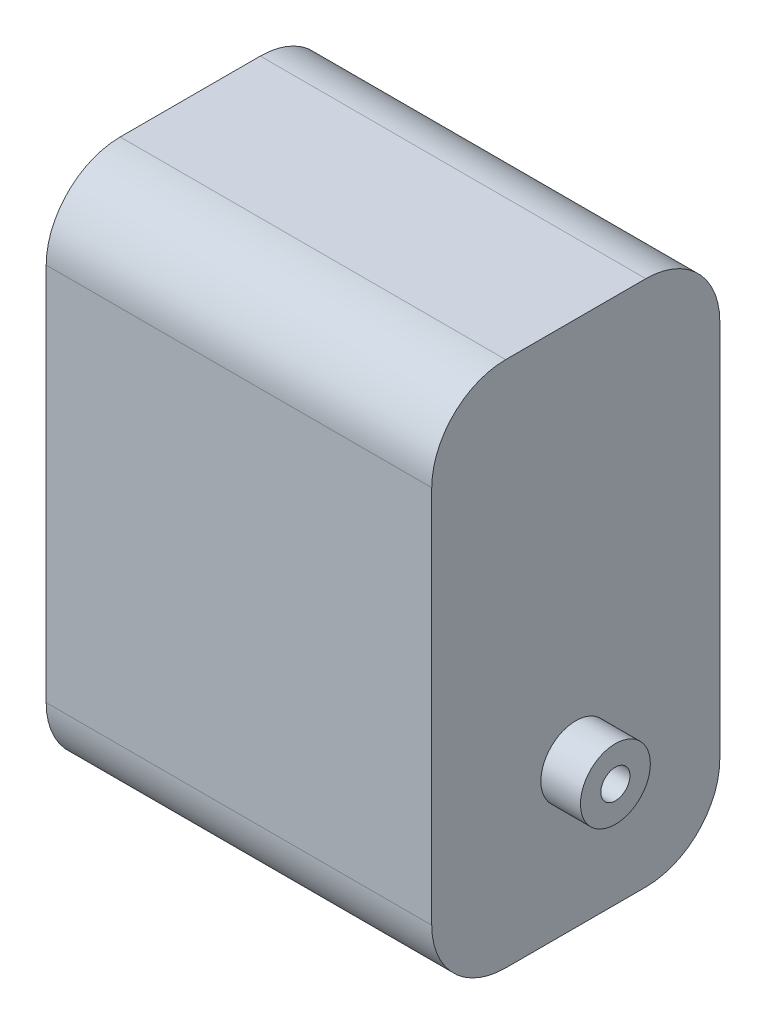
from build123d import *

# Parameters (mm, degrees)
SKETCH1_W           = 24.73
SKETCH1_H           = 45.23
BOSS_EXTRUDE1_DEPTH = 33.1
SKETCH2_R           = 3
SKETCH2_R_2         = 1.25
BOSS_EXTRUDE2_DEPTH = 3.4
FILLET1_R           = 6.35


with BuildPart() as part:
    # Sketch1 → Boss-Extrude1 (new body)
    with BuildSketch(Plane(origin=(0, 0, 0), x_dir=(0, 0, -1), z_dir=(1, 0, 0))):
        Rectangle(SKETCH1_W, SKETCH1_H)
    extrude(amount=BOSS_EXTRUDE1_DEPTH)

    # Sketch2 → Boss-Extrude2 (add)
    with BuildSketch(Plane(origin=(33.1, 0, 0), x_dir=(0, 0, -1), z_dir=(1, 0, 0))):
        with Locations((0, -10.245)):
            Circle(SKETCH2_R)
        with Locations((0, -10.245)):
            Circle(SKETCH2_R_2, mode=Mode.SUBTRACT)
    extrude(amount=BOSS_EXTRUDE2_DEPTH)

    # Fillet1
    fillet1_edges = [part.edges().sort_by_distance(p)[0] for p in [
        (16.55, -22.615, -12.365),
        (16.55, -22.615, 12.365),
        (16.55, 22.615, 12.365),
        (16.55, 22.615, -12.365),
    ]]
    fillet(fillet1_edges, radius=FILLET1_R)


solid = part.part
